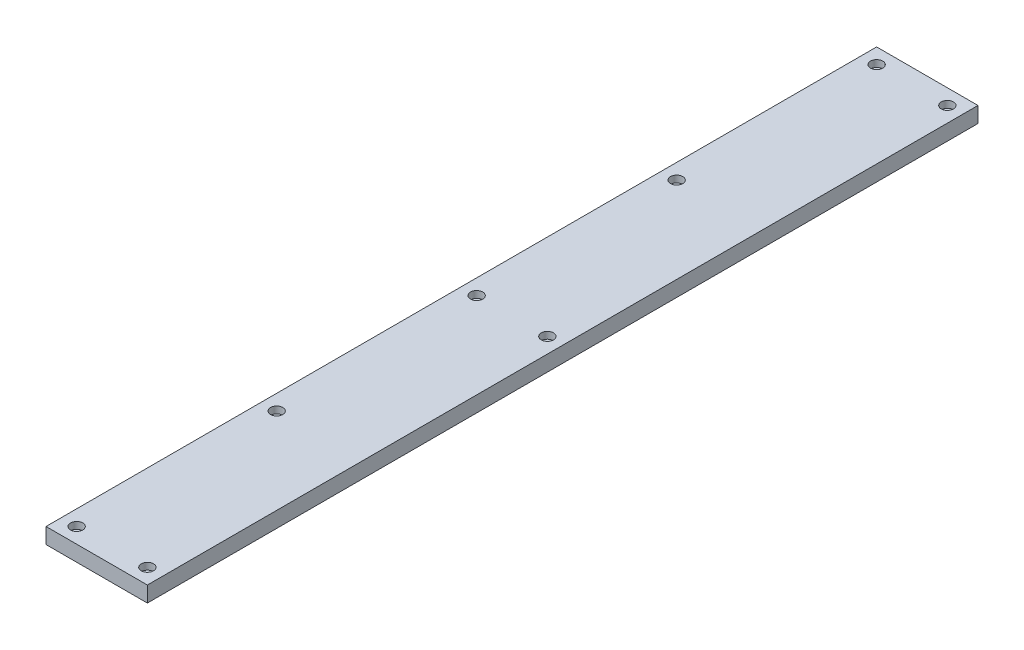
from build123d import *

# Parameters (mm, degrees)
SKETCH1_W                               = 148.89
SKETCH1_H                               = 1220
BOSS_EXTRUDE1_DEPTH                     = 23
CBORE_FOR_M8_HEX_HEAD_BOLT1_D           = 9
CBORE_FOR_M8_HEX_HEAD_BOLT1_CBORE_D     = 18.011
CBORE_FOR_M8_HEX_HEAD_BOLT1_CBORE_DEPTH = 10


with BuildPart() as part:
    # Sketch1 → Boss-Extrude1 (new body)
    with BuildSketch(Plane(origin=(0, 0, 0), x_dir=(1, 0, 0), z_dir=(0, 1, 0))):
        Rectangle(SKETCH1_W, SKETCH1_H)
    extrude(amount=BOSS_EXTRUDE1_DEPTH)

    # CBORE for M8 Hex Head Bolt1 (through all)
    with Locations(Plane(origin=(0, 23, 0), x_dir=(1, 0, 0), z_dir=(0, 1, 0))):
        with Locations((-51.945, 587.5), (51.945, 587.5), (-51.945, 0), (51.945, 0), (-51.945, -587.5), (51.945, -587.5), (-51.945, -293.75), (-51.945, 293.75)):
            CounterBoreHole(CBORE_FOR_M8_HEX_HEAD_BOLT1_D / 2, CBORE_FOR_M8_HEX_HEAD_BOLT1_CBORE_D / 2, CBORE_FOR_M8_HEX_HEAD_BOLT1_CBORE_DEPTH)


solid = part.part
